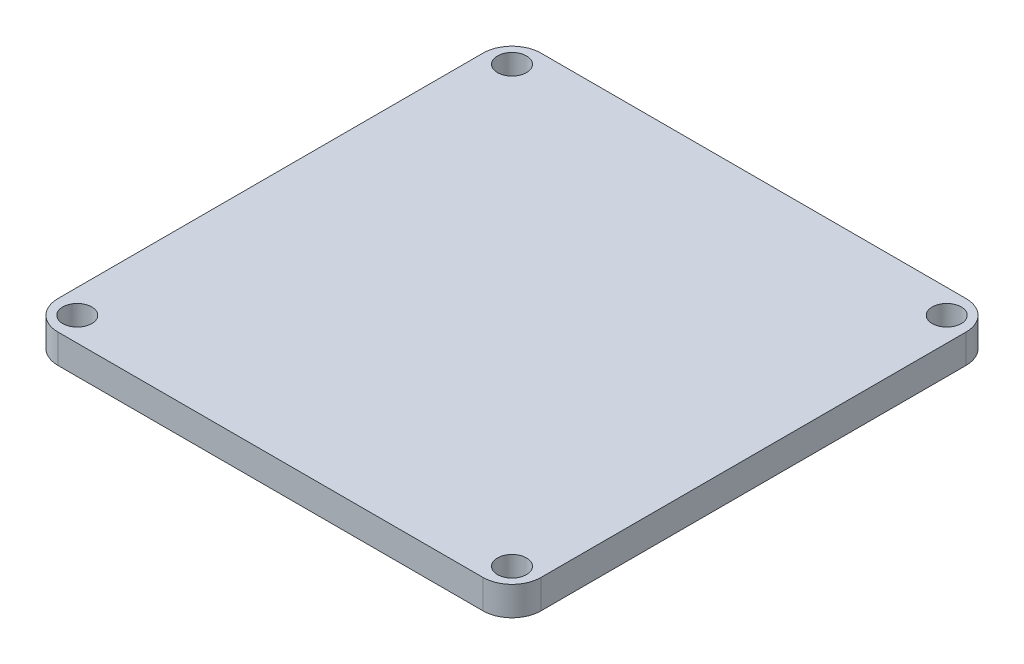
from build123d import *

# Parameters (mm, degrees)
SKETCH_1_R      = 1.5
EXTRUDE_1_DEPTH = 3


with BuildPart() as part:
    # 草圖1 → 填料-伸長1 (new body)
    with BuildSketch(Plane(origin=(0, 0, 0), x_dir=(1, 0, 0), z_dir=(0, 1, 0))):
        with BuildLine():
            Line((-22, 25), (22, 25))
            ThreePointArc((22, 25), (24.121320344, 24.121320344), (25, 22))
            Line((25, 22), (25, -22))
            ThreePointArc((25, -22), (24.121320344, -24.121320344), (22, -25))
            Line((22, -25), (-22, -25))
            ThreePointArc((-22, -25), (-24.121320344, -24.121320344), (-25, -22))
            Line((-25, -22), (-25, 22))
            ThreePointArc((-25, 22), (-24.121320344, 24.121320344), (-22, 25))
        make_face()
        with Locations(Location((-22.5, 22.5, 0), (0, 0, 270))):
            Circle(SKETCH_1_R, mode=Mode.SUBTRACT)
        with Locations(Location((22.5, 22.5, 0), (0, 0, 270))):
            Circle(SKETCH_1_R, mode=Mode.SUBTRACT)
        with Locations(Location((-22.5, -22.5, 0), (0, 0, 270))):
            Circle(SKETCH_1_R, mode=Mode.SUBTRACT)
        with Locations(Location((22.5, -22.5, 0), (0, 0, 270))):
            Circle(SKETCH_1_R, mode=Mode.SUBTRACT)
    extrude(amount=EXTRUDE_1_DEPTH)


solid = part.part
